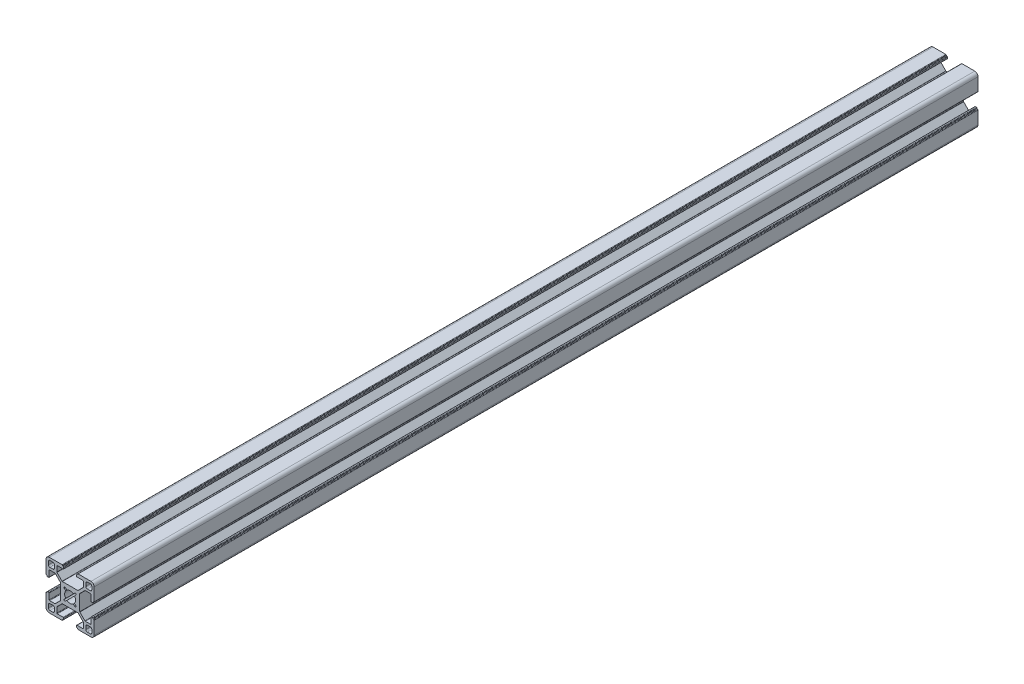
from build123d import *

# Parameters (mm, degrees)
ESTRUSIONE_ESTRUSIONE1_DEPTH = 550


with BuildPart() as part:
    # Schizzo1 → Estrusione-Estrusione1 (new body)
    with BuildSketch(Plane.XY.offset(25)):
        with BuildLine():
            Line((-4.7, -14.7), (-4.7, -14.6))
            ThreePointArc((-4.7, -14.6), (-4.612132034, -14.387867966), (-4.4, -14.3))
            Line((-4.4, -14.3), (-4.3, -14.3))
            ThreePointArc((-4.3, -14.3), (-4.087867966, -14.212132034), (-4, -14))
            Line((-4, -14), (-4, -13.3))
            ThreePointArc((-4, -13.3), (-4.087867966, -13.087867966), (-4.3, -13))
            Line((-4.3, -13), (-7.95, -13))
            ThreePointArc((-7.95, -13), (-8.162132034, -12.912132034), (-8.25, -12.7))
            Line((-8.25, -12.7), (-8.25, -9.43492424))
            ThreePointArc((-8.25, -9.43492424), (-8.22716386, -9.320119211), (-8.162132034, -9.222792206))
            Line((-8.162132034, -9.222792206), (-5.027207794, -6.087867966))
            ThreePointArc((-5.027207794, -6.087867966), (-4.929880789, -6.02283614), (-4.81507576, -6))
            Line((-4.81507576, -6), (4.81507576, -6))
            ThreePointArc((4.81507576, -6), (4.929880789, -6.02283614), (5.027207794, -6.087867966))
            Line((5.027207794, -6.087867966), (8.162132034, -9.222792206))
            ThreePointArc((8.162132034, -9.222792206), (8.22716386, -9.320119211), (8.25, -9.43492424))
            Line((8.25, -9.43492424), (8.25, -12.7))
            ThreePointArc((8.25, -12.7), (8.162132034, -12.912132034), (7.95, -13))
            Line((7.95, -13), (4.3, -13))
            ThreePointArc((4.3, -13), (4.087867966, -13.087867966), (4, -13.3))
            Line((4, -13.3), (4, -14))
            ThreePointArc((4, -14), (4.087867966, -14.212132034), (4.3, -14.3))
            Line((4.3, -14.3), (4.4, -14.3))
            ThreePointArc((4.4, -14.3), (4.612132034, -14.387867966), (4.7, -14.6))
            Line((4.7, -14.6), (4.7, -14.7))
            ThreePointArc((4.7, -14.7), (4.787867966, -14.912132034), (5, -15))
            Line((5, -15), (13, -15))
            ThreePointArc((13, -15), (14.414213562, -14.414213562), (15, -13))
            Line((15, -13), (15, -5))
            ThreePointArc((15, -5), (14.912132034, -4.787867966), (14.7, -4.7))
            Line((14.7, -4.7), (14.6, -4.7))
            ThreePointArc((14.6, -4.7), (14.387867966, -4.612132034), (14.3, -4.4))
            Line((14.3, -4.4), (14.3, -4.3))
            ThreePointArc((14.3, -4.3), (14.212132034, -4.087867966), (14, -4))
            Line((14, -4), (13.3, -4))
            ThreePointArc((13.3, -4), (13.087867966, -4.087867966), (13, -4.3))
            Line((13, -4.3), (13, -7.95))
            ThreePointArc((13, -7.95), (12.912132034, -8.162132034), (12.7, -8.25))
            Line((12.7, -8.25), (9.43492424, -8.25))
            ThreePointArc((9.43492424, -8.25), (9.320119211, -8.22716386), (9.222792206, -8.162132034))
            Line((9.222792206, -8.162132034), (6.087867966, -5.027207794))
            ThreePointArc((6.087867966, -5.027207794), (6.02283614, -4.929880789), (6, -4.81507576))
            Line((6, -4.81507576), (6, 4.81507576))
            ThreePointArc((6, 4.81507576), (6.02283614, 4.929880789), (6.087867966, 5.027207794))
            Line((6.087867966, 5.027207794), (9.222792206, 8.162132034))
            ThreePointArc((9.222792206, 8.162132034), (9.320119211, 8.22716386), (9.43492424, 8.25))
            Line((9.43492424, 8.25), (12.7, 8.25))
            ThreePointArc((12.7, 8.25), (12.912132034, 8.162132034), (13, 7.95))
            Line((13, 7.95), (13, 4.3))
            ThreePointArc((13, 4.3), (13.087867966, 4.087867966), (13.3, 4))
            Line((13.3, 4), (14, 4))
            ThreePointArc((14, 4), (14.212132034, 4.087867966), (14.3, 4.3))
            Line((14.3, 4.3), (14.3, 4.4))
            ThreePointArc((14.3, 4.4), (14.387867966, 4.612132034), (14.6, 4.7))
            Line((14.6, 4.7), (14.7, 4.7))
            ThreePointArc((14.7, 4.7), (14.912132034, 4.787867966), (15, 5))
            Line((15, 5), (15, 13))
            ThreePointArc((15, 13), (14.414213562, 14.414213562), (13, 15))
            Line((13, 15), (5, 15))
            ThreePointArc((5, 15), (4.787867966, 14.912132034), (4.7, 14.7))
            Line((4.7, 14.7), (4.7, 14.6))
            ThreePointArc((4.7, 14.6), (4.612132034, 14.387867966), (4.4, 14.3))
            Line((4.4, 14.3), (4.3, 14.3))
            ThreePointArc((4.3, 14.3), (4.087867966, 14.212132034), (4, 14))
            Line((4, 14), (4, 13.3))
            ThreePointArc((4, 13.3), (4.087867966, 13.087867966), (4.3, 13))
            Line((4.3, 13), (7.95, 13))
            ThreePointArc((7.95, 13), (8.162132034, 12.912132034), (8.25, 12.7))
            Line((8.25, 12.7), (8.25, 9.43492424))
            ThreePointArc((8.25, 9.43492424), (8.22716386, 9.320119211), (8.162132034, 9.222792206))
            Line((8.162132034, 9.222792206), (5.027207794, 6.087867966))
            ThreePointArc((5.027207794, 6.087867966), (4.929880789, 6.02283614), (4.81507576, 6))
            Line((4.81507576, 6), (-4.81507576, 6))
            ThreePointArc((-4.81507576, 6), (-4.929880789, 6.02283614), (-5.027207794, 6.087867966))
            Line((-5.027207794, 6.087867966), (-8.162132034, 9.222792206))
            ThreePointArc((-8.162132034, 9.222792206), (-8.22716386, 9.320119211), (-8.25, 9.43492424))
            Line((-8.25, 9.43492424), (-8.25, 12.7))
            ThreePointArc((-8.25, 12.7), (-8.162132034, 12.912132034), (-7.95, 13))
            Line((-7.95, 13), (-4.3, 13))
            ThreePointArc((-4.3, 13), (-4.087867966, 13.087867966), (-4, 13.3))
            Line((-4, 13.3), (-4, 14))
            ThreePointArc((-4, 14), (-4.087867966, 14.212132034), (-4.3, 14.3))
            Line((-4.3, 14.3), (-4.4, 14.3))
            ThreePointArc((-4.4, 14.3), (-4.612132034, 14.387867966), (-4.7, 14.6))
            Line((-4.7, 14.6), (-4.7, 14.7))
            ThreePointArc((-4.7, 14.7), (-4.787867966, 14.912132034), (-5, 15))
            Line((-5, 15), (-13, 15))
            ThreePointArc((-13, 15), (-14.414213562, 14.414213562), (-15, 13))
            Line((-15, 13), (-15, 5))
            ThreePointArc((-15, 5), (-14.912132034, 4.787867966), (-14.7, 4.7))
            Line((-14.7, 4.7), (-14.6, 4.7))
            ThreePointArc((-14.6, 4.7), (-14.387867966, 4.612132034), (-14.3, 4.4))
            Line((-14.3, 4.4), (-14.3, 4.3))
            ThreePointArc((-14.3, 4.3), (-14.212132034, 4.087867966), (-14, 4))
            Line((-14, 4), (-13.3, 4))
            ThreePointArc((-13.3, 4), (-13.087867966, 4.087867966), (-13, 4.3))
            Line((-13, 4.3), (-13, 7.95))
            ThreePointArc((-13, 7.95), (-12.912132034, 8.162132034), (-12.7, 8.25))
            Line((-12.7, 8.25), (-9.43492424, 8.25))
            ThreePointArc((-9.43492424, 8.25), (-9.320119211, 8.22716386), (-9.222792206, 8.162132034))
            Line((-9.222792206, 8.162132034), (-6.087867966, 5.027207794))
            ThreePointArc((-6.087867966, 5.027207794), (-6.02283614, 4.929880789), (-6, 4.81507576))
            Line((-6, 4.81507576), (-6, -4.81507576))
            ThreePointArc((-6, -4.81507576), (-6.02283614, -4.929880789), (-6.087867966, -5.027207794))
            Line((-6.087867966, -5.027207794), (-9.222792206, -8.162132034))
            ThreePointArc((-9.222792206, -8.162132034), (-9.320119211, -8.22716386), (-9.43492424, -8.25))
            Line((-9.43492424, -8.25), (-12.7, -8.25))
            ThreePointArc((-12.7, -8.25), (-12.912132034, -8.162132034), (-13, -7.95))
            Line((-13, -7.95), (-13, -4.3))
            ThreePointArc((-13, -4.3), (-13.087867966, -4.087867966), (-13.3, -4))
            Line((-13.3, -4), (-14, -4))
            ThreePointArc((-14, -4), (-14.212132034, -4.087867966), (-14.3, -4.3))
            Line((-14.3, -4.3), (-14.3, -4.4))
            ThreePointArc((-14.3, -4.4), (-14.387867966, -4.612132034), (-14.6, -4.7))
            Line((-14.6, -4.7), (-14.7, -4.7))
            ThreePointArc((-14.7, -4.7), (-14.912132034, -4.787867966), (-15, -5))
            Line((-15, -5), (-15, -13))
            ThreePointArc((-15, -13), (-14.414213562, -14.414213562), (-13, -15))
            Line((-13, -15), (-5, -15))
            ThreePointArc((-5, -15), (-4.787867966, -14.912132034), (-4.7, -14.7))
        make_face()
        with BuildLine():
            Line((-12.5625, -9.75), (-10.6875, -9.75))
            ThreePointArc((-10.6875, -9.75), (-10.024587393, -10.024587393), (-9.75, -10.6875))
            Line((-9.75, -10.6875), (-9.75, -12.5625))
            ThreePointArc((-9.75, -12.5625), (-10.024587393, -13.225412607), (-10.6875, -13.5))
            Line((-10.6875, -13.5), (-12.5625, -13.5))
            ThreePointArc((-12.5625, -13.5), (-13.225412607, -13.225412607), (-13.5, -12.5625))
            Line((-13.5, -12.5625), (-13.5, -10.6875))
            ThreePointArc((-13.5, -10.6875), (-13.225412607, -10.024587393), (-12.5625, -9.75))
        make_face(mode=Mode.SUBTRACT)
        with BuildLine():
            Line((12.5625, 9.75), (10.6875, 9.75))
            ThreePointArc((10.6875, 9.75), (10.024587393, 10.024587393), (9.75, 10.6875))
            Line((9.75, 10.6875), (9.75, 12.5625))
            ThreePointArc((9.75, 12.5625), (10.024587393, 13.225412607), (10.6875, 13.5))
            Line((10.6875, 13.5), (12.5625, 13.5))
            ThreePointArc((12.5625, 13.5), (13.225412607, 13.225412607), (13.5, 12.5625))
            Line((13.5, 12.5625), (13.5, 10.6875))
            ThreePointArc((13.5, 10.6875), (13.225412607, 10.024587393), (12.5625, 9.75))
        make_face(mode=Mode.SUBTRACT)
        with BuildLine():
            Line((2.010111251, 2.742162059), (2.867949192, 3.6))
            ThreePointArc((2.867949192, 3.6), (3.6, 3.6), (3.6, 2.867949192))
            Line((3.6, 2.867949192), (2.742162059, 2.010111251))
            ThreePointArc((2.742162059, 2.010111251), (3.4, 0), (2.742162059, -2.010111251))
            Line((2.742162059, -2.010111251), (3.6, -2.867949192))
            ThreePointArc((3.6, -2.867949192), (3.6, -3.6), (2.867949192, -3.6))
            Line((2.867949192, -3.6), (2.010111251, -2.742162059))
            ThreePointArc((2.010111251, -2.742162059), (0, -3.4), (-2.010111251, -2.742162059))
            Line((-2.010111251, -2.742162059), (-2.867949192, -3.6))
            ThreePointArc((-2.867949192, -3.6), (-3.6, -3.6), (-3.6, -2.867949192))
            Line((-3.6, -2.867949192), (-2.742162059, -2.010111251))
            ThreePointArc((-2.742162059, -2.010111251), (-3.4, 0), (-2.742162059, 2.010111251))
            Line((-2.742162059, 2.010111251), (-3.6, 2.867949192))
            ThreePointArc((-3.6, 2.867949192), (-3.6, 3.6), (-2.867949192, 3.6))
            Line((-2.867949192, 3.6), (-2.010111251, 2.742162059))
            ThreePointArc((-2.010111251, 2.742162059), (0, 3.4), (2.010111251, 2.742162059))
        make_face(mode=Mode.SUBTRACT)
        with BuildLine():
            Line((-9.75, 12.5625), (-9.75, 10.6875))
            ThreePointArc((-9.75, 10.6875), (-10.024587393, 10.024587393), (-10.6875, 9.75))
            Line((-10.6875, 9.75), (-12.5625, 9.75))
            ThreePointArc((-12.5625, 9.75), (-13.225412607, 10.024587393), (-13.5, 10.6875))
            Line((-13.5, 10.6875), (-13.5, 12.5625))
            ThreePointArc((-13.5, 12.5625), (-13.225412607, 13.225412607), (-12.5625, 13.5))
            Line((-12.5625, 13.5), (-10.6875, 13.5))
            ThreePointArc((-10.6875, 13.5), (-10.024587393, 13.225412607), (-9.75, 12.5625))
        make_face(mode=Mode.SUBTRACT)
        with BuildLine():
            Line((9.75, -12.5625), (9.75, -10.6875))
            ThreePointArc((9.75, -10.6875), (10.024587393, -10.024587393), (10.6875, -9.75))
            Line((10.6875, -9.75), (12.5625, -9.75))
            ThreePointArc((12.5625, -9.75), (13.225412607, -10.024587393), (13.5, -10.6875))
            Line((13.5, -10.6875), (13.5, -12.5625))
            ThreePointArc((13.5, -12.5625), (13.225412607, -13.225412607), (12.5625, -13.5))
            Line((12.5625, -13.5), (10.6875, -13.5))
            ThreePointArc((10.6875, -13.5), (10.024587393, -13.225412607), (9.75, -12.5625))
        make_face(mode=Mode.SUBTRACT)
    extrude(amount=-ESTRUSIONE_ESTRUSIONE1_DEPTH)


solid = part.part
